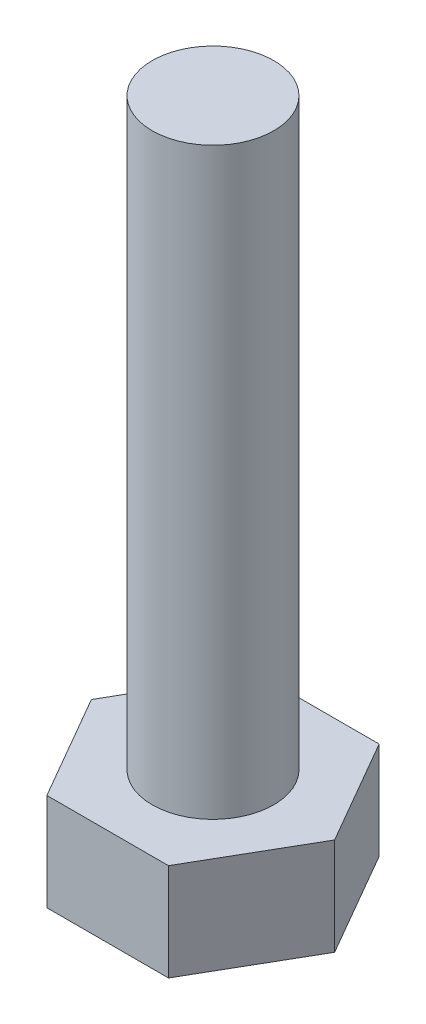
from build123d import *

# Parameters (mm, degrees)
EXTRUDE_1_DEPTH = 2
SKETCH_2_R      = 1.25
EXTRUDE_2_DEPTH = 12


with BuildPart() as part:
    # 草图1 → 凸台-拉伸1 (new body)
    with BuildSketch(Plane(origin=(0, 0, 0), x_dir=(1, 0, 0), z_dir=(0, 1, 0))):
        Polygon((2.5, 0), (1.25, 2.165063509), (-1.25, 2.165063509), (-2.5, 0), (-1.25, -2.165063509), (1.25, -2.165063509), align=None)
    extrude(amount=EXTRUDE_1_DEPTH)

    # 草图2 → 凸台-拉伸2 (add)
    with BuildSketch(Plane(origin=(0, 2, 0), x_dir=(1, 0, 0), z_dir=(0, 1, 0))):
        with Locations(Location((0, 0, 0), (0, 0, 270))):
            Circle(SKETCH_2_R)
    extrude(amount=EXTRUDE_2_DEPTH)


solid = part.part
